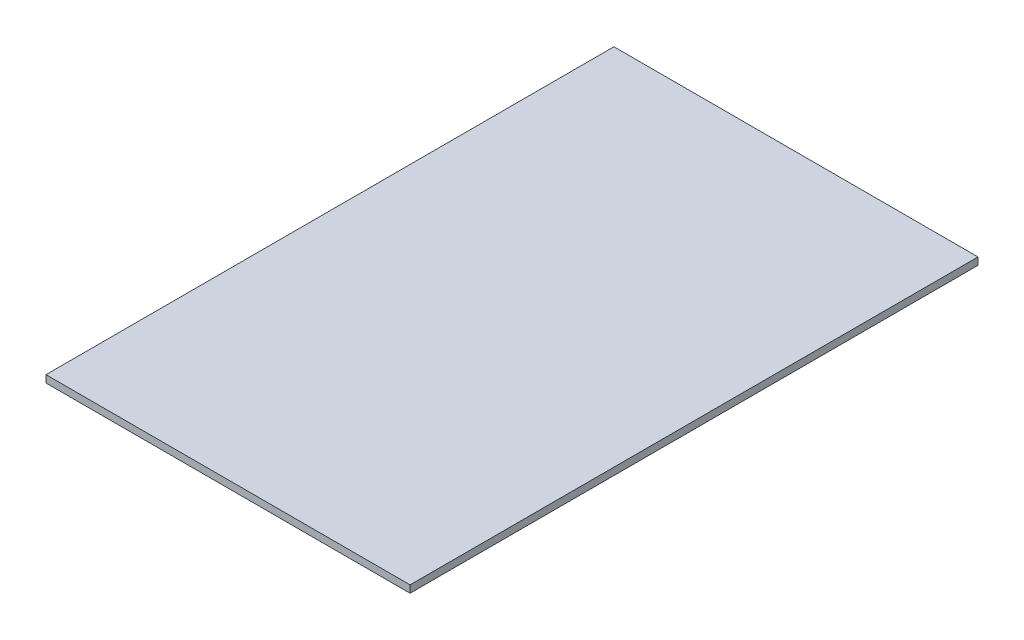
from build123d import *

# Parameters (mm, degrees)
SKETCH1_W           = 317.5
SKETCH1_H           = 495.3
BOSS_EXTRUDE1_DEPTH = 6.35


with BuildPart() as part:
    # Sketch1 → Boss-Extrude1 (new body)
    with BuildSketch(Plane(origin=(0, 0, 0), x_dir=(1, 0, 0), z_dir=(0, 1, 0))):
        Rectangle(SKETCH1_W, SKETCH1_H)
    extrude(amount=BOSS_EXTRUDE1_DEPTH)


solid = part.part
